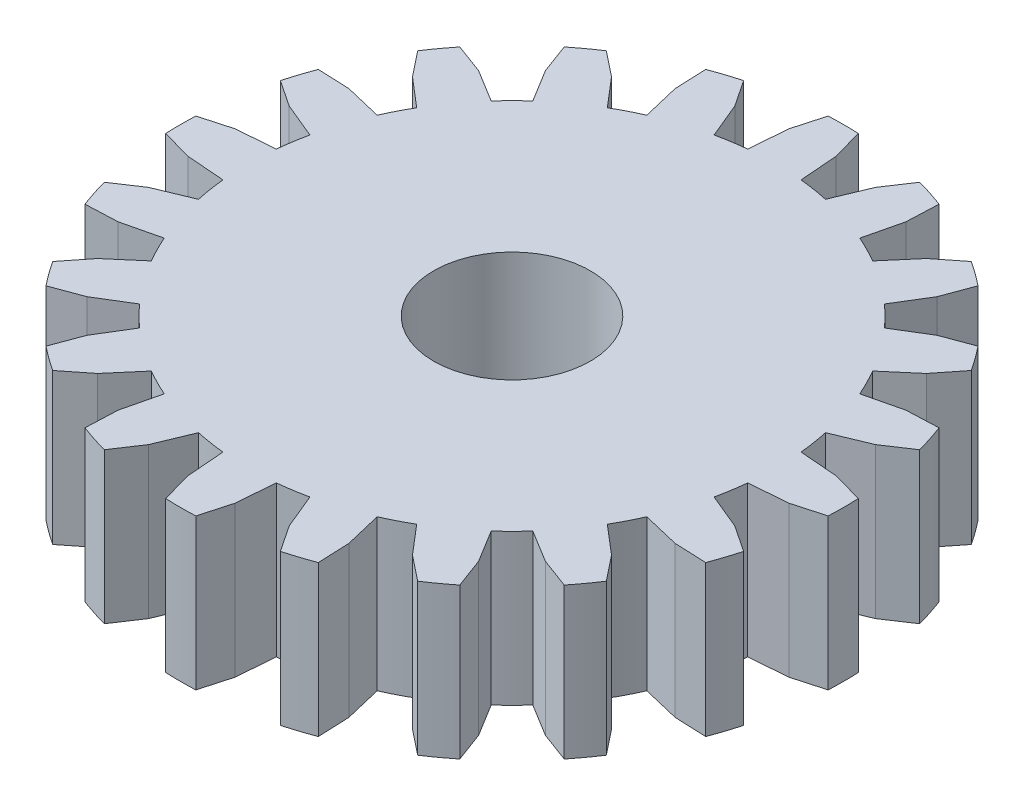
from build123d import *

# Parameters (mm, degrees)
SKETCH1_R           = 2.6
BOSS_EXTRUDE1_DEPTH = 5


with BuildPart() as part:
    # Sketch1 → Boss-Extrude1 (new body)
    with BuildSketch(Plane(origin=(0, 0, 0), x_dir=(1, 0, 0), z_dir=(0, 1, 0))):
        with BuildLine():
            Line((0.885, 8.705129235), (0.785, 9.969141137))
            Line((0.785, 9.969141137), (0.5, 10.988630488))
            ThreePointArc((0.5, 10.988630488), (0, 11), (-0.5, 10.988630488))
            Line((-0.5, 10.988630488), (-0.785, 9.969141137))
            Line((-0.785, 9.969141137), (-0.885, 8.705129235))
            ThreePointArc((-0.885, 8.705129235), (-1.368801569, 8.64227298), (-1.848347855, 8.552549924))
            Line((-1.848347855, 8.552549924), (-2.334054665, 9.72379498))
            Line((-2.334054665, 9.72379498), (-2.920145308, 10.605317128))
            ThreePointArc((-2.920145308, 10.605317128), (-3.399186938, 10.461621679), (-3.871201824, 10.296300134))
            Line((-3.871201824, 10.296300134), (-3.827213396, 9.238638299))
            Line((-3.827213396, 9.238638299), (-3.531717889, 8.005589844))
            ThreePointArc((-3.531717889, 8.005589844), (-3.972416873, 7.796307087), (-4.400766544, 7.562787438))
            Line((-4.400766544, 7.562787438), (-5.224635797, 8.526616022))
            Line((-5.224635797, 8.526616022), (-6.054446447, 9.183881436))
            ThreePointArc((-6.054446447, 9.183881436), (-6.465637775, 8.899186938), (-6.863463441, 8.596096183))
            Line((-6.863463441, 8.596096183), (-6.494792479, 7.603793176))
            Line((-6.494792479, 7.603793176), (-5.832726624, 6.522407541))
            ThreePointArc((-5.832726624, 6.522407541), (-6.187184335, 6.187184335), (-6.522407541, 5.832726624))
            Line((-6.522407541, 5.832726624), (-7.603793176, 6.494792479))
            Line((-7.603793176, 6.494792479), (-8.596096183, 6.863463441))
            ThreePointArc((-8.596096183, 6.863463441), (-8.899186938, 6.465637775), (-9.183881436, 6.054446447))
            Line((-9.183881436, 6.054446447), (-8.526616022, 5.224635797))
            Line((-8.526616022, 5.224635797), (-7.562787438, 4.400766544))
            ThreePointArc((-7.562787438, 4.400766544), (-7.796307087, 3.972416873), (-8.005589844, 3.531717889))
            Line((-8.005589844, 3.531717889), (-9.238638299, 3.827213396))
            Line((-9.238638299, 3.827213396), (-10.296300134, 3.871201824))
            ThreePointArc((-10.296300134, 3.871201824), (-10.461621679, 3.399186938), (-10.605317128, 2.920145308))
            Line((-10.605317128, 2.920145308), (-9.72379498, 2.334054665))
            Line((-9.72379498, 2.334054665), (-8.552549924, 1.848347855))
            ThreePointArc((-8.552549924, 1.848347855), (-8.64227298, 1.368801569), (-8.705129235, 0.885))
            Line((-8.705129235, 0.885), (-9.969141137, 0.785))
            Line((-9.969141137, 0.785), (-10.988630488, 0.5))
            ThreePointArc((-10.988630488, 0.5), (-11, 0), (-10.988630488, -0.5))
            Line((-10.988630488, -0.5), (-9.969141137, -0.785))
            Line((-9.969141137, -0.785), (-8.705129235, -0.885))
            ThreePointArc((-8.705129235, -0.885), (-8.64227298, -1.368801569), (-8.552549924, -1.848347855))
            Line((-8.552549924, -1.848347855), (-9.72379498, -2.334054665))
            Line((-9.72379498, -2.334054665), (-10.605317128, -2.920145308))
            ThreePointArc((-10.605317128, -2.920145308), (-10.461621679, -3.399186938), (-10.296300134, -3.871201824))
            Line((-10.296300134, -3.871201824), (-9.238638299, -3.827213396))
            Line((-9.238638299, -3.827213396), (-8.005589844, -3.531717889))
            ThreePointArc((-8.005589844, -3.531717889), (-7.796307087, -3.972416873), (-7.562787438, -4.400766544))
            Line((-7.562787438, -4.400766544), (-8.526616022, -5.224635797))
            Line((-8.526616022, -5.224635797), (-9.183881436, -6.054446447))
            ThreePointArc((-9.183881436, -6.054446447), (-8.899186938, -6.465637775), (-8.596096183, -6.863463441))
            Line((-8.596096183, -6.863463441), (-7.603793176, -6.494792479))
            Line((-7.603793176, -6.494792479), (-6.522407541, -5.832726624))
            ThreePointArc((-6.522407541, -5.832726624), (-6.187184335, -6.187184335), (-5.832726624, -6.522407541))
            Line((-5.832726624, -6.522407541), (-6.494792479, -7.603793176))
            Line((-6.494792479, -7.603793176), (-6.863463441, -8.596096183))
            ThreePointArc((-6.863463441, -8.596096183), (-6.465637775, -8.899186938), (-6.054446447, -9.183881436))
            Line((-6.054446447, -9.183881436), (-5.224635797, -8.526616022))
            Line((-5.224635797, -8.526616022), (-4.400766544, -7.562787438))
            ThreePointArc((-4.400766544, -7.562787438), (-3.972416873, -7.796307087), (-3.531717889, -8.005589844))
            Line((-3.531717889, -8.005589844), (-3.827213396, -9.238638299))
            Line((-3.827213396, -9.238638299), (-3.871201824, -10.296300134))
            ThreePointArc((-3.871201824, -10.296300134), (-3.399186938, -10.461621679), (-2.920145308, -10.605317128))
            Line((-2.920145308, -10.605317128), (-2.334054665, -9.72379498))
            Line((-2.334054665, -9.72379498), (-1.848347855, -8.552549924))
            ThreePointArc((-1.848347855, -8.552549924), (-1.368801569, -8.64227298), (-0.885, -8.705129235))
            Line((-0.885, -8.705129235), (-0.785, -9.969141137))
            Line((-0.785, -9.969141137), (-0.5, -10.988630488))
            ThreePointArc((-0.5, -10.988630488), (0, -11), (0.5, -10.988630488))
            Line((0.5, -10.988630488), (0.785, -9.969141137))
            Line((0.785, -9.969141137), (0.885, -8.705129235))
            ThreePointArc((0.885, -8.705129235), (1.368801569, -8.64227298), (1.848347855, -8.552549924))
            Line((1.848347855, -8.552549924), (2.334054665, -9.72379498))
            Line((2.334054665, -9.72379498), (2.920145308, -10.605317128))
            ThreePointArc((2.920145308, -10.605317128), (3.399186938, -10.461621679), (3.871201824, -10.296300134))
            Line((3.871201824, -10.296300134), (3.827213396, -9.238638299))
            Line((3.827213396, -9.238638299), (3.531717889, -8.005589844))
            ThreePointArc((3.531717889, -8.005589844), (3.972416873, -7.796307087), (4.400766544, -7.562787438))
            Line((4.400766544, -7.562787438), (5.224635797, -8.526616022))
            Line((5.224635797, -8.526616022), (6.054446447, -9.183881436))
            ThreePointArc((6.054446447, -9.183881436), (6.465637775, -8.899186938), (6.863463441, -8.596096183))
            Line((6.863463441, -8.596096183), (6.494792479, -7.603793176))
            Line((6.494792479, -7.603793176), (5.832726624, -6.522407541))
            ThreePointArc((5.832726624, -6.522407541), (6.187184335, -6.187184335), (6.522407541, -5.832726624))
            Line((6.522407541, -5.832726624), (7.603793176, -6.494792479))
            Line((7.603793176, -6.494792479), (8.596096183, -6.863463441))
            ThreePointArc((8.596096183, -6.863463441), (8.899186938, -6.465637775), (9.183881436, -6.054446447))
            Line((9.183881436, -6.054446447), (8.526616022, -5.224635797))
            Line((8.526616022, -5.224635797), (7.562787438, -4.400766544))
            ThreePointArc((7.562787438, -4.400766544), (7.796307087, -3.972416873), (8.005589844, -3.531717889))
            Line((8.005589844, -3.531717889), (9.238638299, -3.827213396))
            Line((9.238638299, -3.827213396), (10.296300134, -3.871201824))
            ThreePointArc((10.296300134, -3.871201824), (10.461621679, -3.399186938), (10.605317128, -2.920145308))
            Line((10.605317128, -2.920145308), (9.72379498, -2.334054665))
            Line((9.72379498, -2.334054665), (8.552549924, -1.848347855))
            ThreePointArc((8.552549924, -1.848347855), (8.64227298, -1.368801569), (8.705129235, -0.885))
            Line((8.705129235, -0.885), (9.969141137, -0.785))
            Line((9.969141137, -0.785), (10.988630488, -0.5))
            ThreePointArc((10.988630488, -0.5), (11, 0), (10.988630488, 0.5))
            Line((10.988630488, 0.5), (9.969141137, 0.785))
            Line((9.969141137, 0.785), (8.705129235, 0.885))
            ThreePointArc((8.705129235, 0.885), (8.64227298, 1.368801569), (8.552549924, 1.848347855))
            Line((8.552549924, 1.848347855), (9.72379498, 2.334054665))
            Line((9.72379498, 2.334054665), (10.605317128, 2.920145308))
            ThreePointArc((10.605317128, 2.920145308), (10.461621679, 3.399186938), (10.296300134, 3.871201824))
            Line((10.296300134, 3.871201824), (9.238638299, 3.827213396))
            Line((9.238638299, 3.827213396), (8.005589844, 3.531717889))
            ThreePointArc((8.005589844, 3.531717889), (7.796307087, 3.972416873), (7.562787438, 4.400766544))
            Line((7.562787438, 4.400766544), (8.526616022, 5.224635797))
            Line((8.526616022, 5.224635797), (9.183881436, 6.054446447))
            ThreePointArc((9.183881436, 6.054446447), (8.899186938, 6.465637775), (8.596096183, 6.863463441))
            Line((8.596096183, 6.863463441), (7.603793176, 6.494792479))
            Line((7.603793176, 6.494792479), (6.522407541, 5.832726624))
            ThreePointArc((6.522407541, 5.832726624), (6.187184335, 6.187184335), (5.832726624, 6.522407541))
            Line((5.832726624, 6.522407541), (6.494792479, 7.603793176))
            Line((6.494792479, 7.603793176), (6.863463441, 8.596096183))
            ThreePointArc((6.863463441, 8.596096183), (6.465637775, 8.899186938), (6.054446447, 9.183881436))
            Line((6.054446447, 9.183881436), (5.224635797, 8.526616022))
            Line((5.224635797, 8.526616022), (4.400766544, 7.562787438))
            ThreePointArc((4.400766544, 7.562787438), (3.972416873, 7.796307087), (3.531717889, 8.005589844))
            Line((3.531717889, 8.005589844), (3.827213396, 9.238638299))
            Line((3.827213396, 9.238638299), (3.871201824, 10.296300134))
            ThreePointArc((3.871201824, 10.296300134), (3.399186938, 10.461621679), (2.920145308, 10.605317128))
            Line((2.920145308, 10.605317128), (2.334054665, 9.72379498))
            Line((2.334054665, 9.72379498), (1.848347855, 8.552549924))
            ThreePointArc((1.848347855, 8.552549924), (1.368801569, 8.64227298), (0.885, 8.705129235))
        make_face()
        with Locations(Location((0, 0, 0), (0, 0, 270))):
            Circle(SKETCH1_R, mode=Mode.SUBTRACT)
    extrude(amount=BOSS_EXTRUDE1_DEPTH)


solid = part.part
